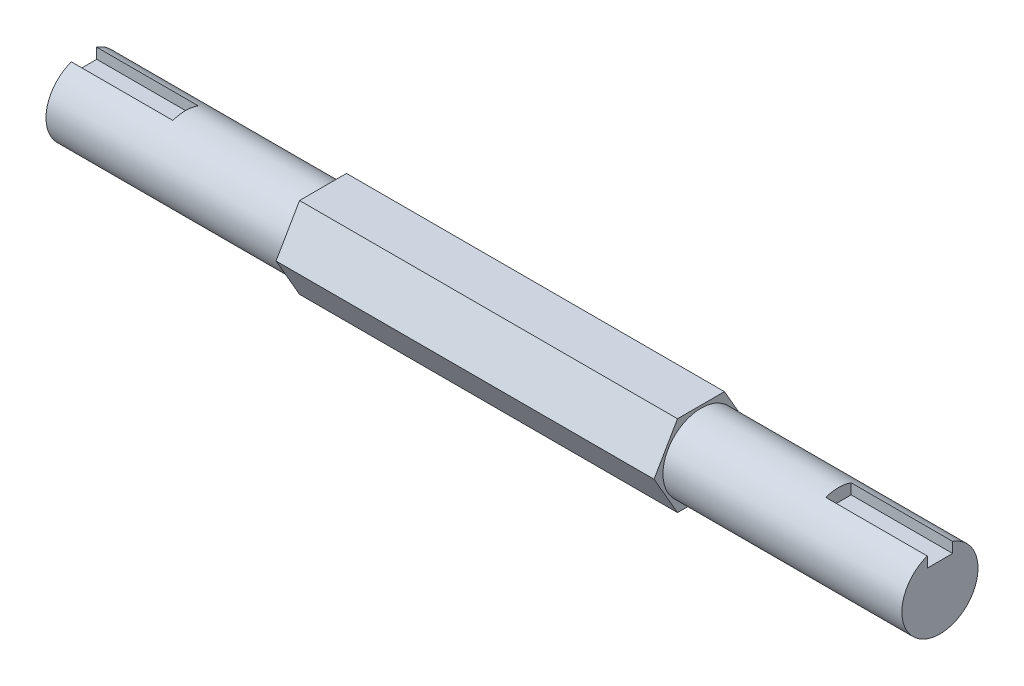
from build123d import *

# Parameters (mm, degrees)
SKETCH1_R           = 15
BOSS_EXTRUDE2_DEPTH = 168.7
BOSS_EXTRUDE3_DEPTH = 74.5
SKETCH3_W           = 10
SKETCH3_H           = 10
CUT_EXTRUDE1_DEPTH  = 40


with BuildPart() as part:
    # Sketch1 → Boss-Extrude2 (new, symmetric)
    with BuildSketch(Plane(origin=(0, 0, 0), x_dir=(0, 0, -1), z_dir=(1, 0, 0))):
        Circle(SKETCH1_R)
    extrude(amount=BOSS_EXTRUDE2_DEPTH, both=True)

    # Sketch2 → Boss-Extrude3 (add, symmetric)
    with BuildSketch(Plane(origin=(0, 0, 0), x_dir=(0, 0, -1), z_dir=(1, 0, 0))):
        Polygon((-18.504076128, 0), (-9.252038064, -16.025), (9.252038064, -16.025), (18.504076128, 0), (9.252038064, 16.025), (-9.252038064, 16.025), align=None)
    extrude(amount=BOSS_EXTRUDE3_DEPTH, both=True)

    # Sketch3 → Cut-Extrude1 (cut)
    with BuildSketch(Plane(origin=(168.7, 0, 0), x_dir=(0, 0, -1), z_dir=(1, 0, 0))):
        with Locations((0, 15)):
            Rectangle(SKETCH3_W, SKETCH3_H)
    cut_extrude1 = extrude(amount=-CUT_EXTRUDE1_DEPTH, mode=Mode.SUBTRACT)

    # Mirror1: Cut-Extrude1 across plane
    add(cut_extrude1.mirror(Plane(origin=(0, 0, 0), x_dir=(0, 0, 1), z_dir=(1, 0, 0))), mode=Mode.SUBTRACT)


solid = part.part
